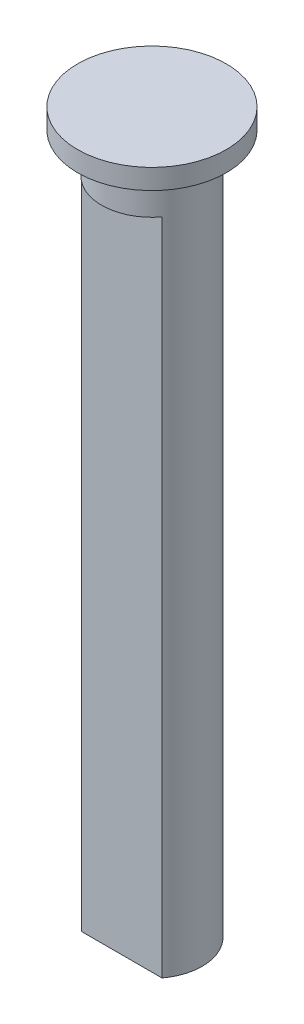
from build123d import *

# Parameters (mm, degrees)
EXTRUDE_1_DEPTH = 27.8
SKETCH_2_R      = 2.5
EXTRUDE_2_DEPTH = 2
SKETCH_3_R      = 3.7
EXTRUDE_3_DEPTH = 1
EXTRUDE_START   = 2
EXTRUDE_4_DEPTH = 2
EXTRUDE_START_2 = 3
EXTRUDE_5_DEPTH = 3


with BuildPart() as part:
    # 草图1 → 凸台-拉伸1 (new body)
    with BuildSketch(Plane(origin=(0, 0, 0), x_dir=(1, 0, 0), z_dir=(0, 1, 0))):
        with BuildLine():
            Line((-2, -1.5), (2, -1.5))
            ThreePointArc((2, -1.5), (0, 2.5), (-2, -1.5))
        make_face()
    extrude(amount=EXTRUDE_1_DEPTH)

    # 草图2 → 凸台-拉伸2 (add)
    with BuildSketch(Plane(origin=(0, 27.8, 0), x_dir=(1, 0, 0), z_dir=(0, 1, 0))):
        with Locations(Location((0, 0, 0), (0, 0, 216.869897646))):
            Circle(SKETCH_2_R)
    extrude(amount=EXTRUDE_2_DEPTH)

    # 草图3 → 凸台-拉伸3 (add)
    with BuildSketch(Plane(origin=(0, 29.8, 0), x_dir=(1, 0, 0), z_dir=(0, 1, 0))):
        with Locations(Location((0, 0, 0), (0, 0, 270))):
            Circle(SKETCH_3_R)
    extrude(amount=EXTRUDE_3_DEPTH)

    # 草图4 → 凸台-拉伸4 (add)
    with BuildSketch(Plane.XZ.offset(EXTRUDE_START)):
        with BuildLine():
            Line((-2, 1.5), (2, 1.5))
            ThreePointArc((2, 1.5), (0, -2.5), (-2, 1.5))
        make_face()
    extrude(amount=-EXTRUDE_4_DEPTH)

    # 草图5 → 凸台-拉伸5 (add)
    with BuildSketch(Plane.XZ.offset(2).offset(EXTRUDE_START_2)):
        with BuildLine():
            Line((-2, 1.5), (2, 1.5))
            ThreePointArc((2, 1.5), (0, -2.5), (-2, 1.5))
        make_face()
    extrude(amount=-EXTRUDE_5_DEPTH)


solid = part.part
